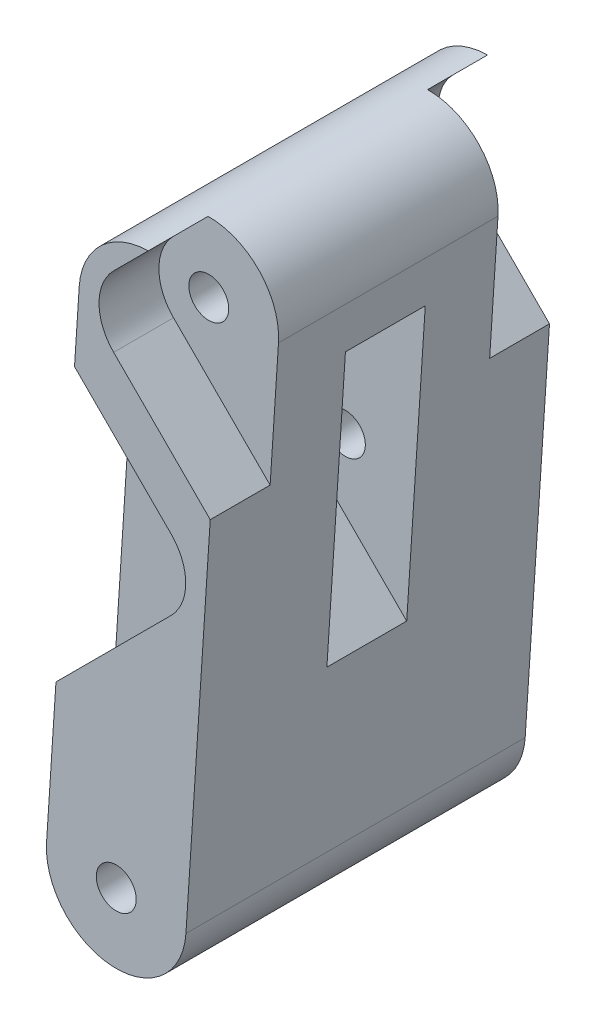
from build123d import *

# Parameters (mm, degrees)
SKETCH1_R           = 1
BOSS_EXTRUDE1_DEPTH = 8.5
CUT_EXTRUDE1_DEPTH  = 2
CUT_EXTRUDE2_START  = -3
CUT_EXTRUDE2_DEPTH  = 3


with BuildPart() as part:
    # Sketch1 → Boss-Extrude1 (new body)
    with BuildSketch(Plane.XY):
        with BuildLine():
            Line((12.42679356, 42.170979879), (10.789298219, 17.224665341))
            ThreePointArc((10.789298219, 17.224665341), (7.067564836, 13.961430653), (3.804330148, 17.683164036))
            Line((3.804330148, 17.683164036), (5.441825489, 42.629478574))
            ThreePointArc((5.441825489, 42.629478574), (9.163558872, 45.892713262), (12.42679356, 42.170979879))
        make_face()
        with Locations((7.296814184, 17.453914689)):
            Circle(SKETCH1_R, mode=Mode.SUBTRACT)
        with Locations((8.279311388, 32.421703411)):
            Circle(SKETCH1_R, mode=Mode.SUBTRACT)
        with Locations((8.934309525, 42.400229226)):
            Circle(SKETCH1_R, mode=Mode.SUBTRACT)
    boss_extrude1 = extrude(amount=BOSS_EXTRUDE1_DEPTH)

    # Sketch2 → Cut-Extrude1 (cut)
    # profile 1 of 2: a face of its own
    with BuildSketch(Plane(origin=(0, 0, 0), x_dir=(-1, 0, 0), z_dir=(0, 0, -1))):
        with BuildLine():
            ThreePointArc((-6.511544435, 30.653936458), (-5.779311388, 32.421703411), (-6.511544435, 34.189470364))
            Line((-6.511544435, 34.189470364), (-12.281634265, 39.959560194))
            Line((-12.281634265, 39.959560194), (-11.353008502, 25.812472391))
            Line((-11.353008502, 25.812472391), (-6.511544435, 30.653936458))
        make_face()
        with BuildLine():
            ThreePointArc((-7.279311388, 32.421703411), (-7.355431856, 32.039019979), (-7.572204607, 31.71459663))
            ThreePointArc((-7.572204607, 31.71459663), (-9.203190921, 32.804386844), (-7.279311388, 32.421703411))
        make_face(mode=Mode.SUBTRACT)
    # profile 2 of 2: a face of its own
    with BuildSketch(Plane(origin=(0, 0, 0), x_dir=(-1, 0, 0), z_dir=(0, 0, -1))):
        with BuildLine():
            ThreePointArc((-9.064581137, 19.221681642), (-9.796814184, 17.453914689), (-9.064581137, 15.686147736))
            Line((-9.064581137, 15.686147736), (-3.30921397, 9.930780569))
            Line((-3.30921397, 9.930780569), (-3.30921397, 24.977048808))
            Line((-3.30921397, 24.977048808), (-9.064581137, 19.221681642))
        make_face()
    cut_extrude1 = extrude(amount=-CUT_EXTRUDE1_DEPTH, mode=Mode.SUBTRACT)

    # Sketch3 → Cut-Extrude2 (cut)
    with BuildSketch(Plane.XY.offset(8.5).offset(CUT_EXTRUDE2_START)):
        with BuildLine():
            Line((7.166542572, 44.167996179), (14.185239134, 51.186692741))
            Line((14.185239134, 51.186692741), (14.789130122, 33.009874723))
            Line((14.789130122, 33.009874723), (7.166542572, 40.632462273))
            ThreePointArc((7.166542572, 40.632462273), (6.434309525, 42.400229226), (7.166542572, 44.167996179))
        make_face()
        with BuildLine():
            Line((10.047078341, 34.189470364), (4.005126991, 40.231421715))
            Line((4.005126991, 40.231421715), (3.260559385, 23.867417502))
            Line((3.260559385, 23.867417502), (10.047078341, 30.653936458))
            ThreePointArc((10.047078341, 30.653936458), (10.779311388, 32.421703411), (10.047078341, 34.189470364))
        make_face()
    cut_extrude2 = extrude(amount=CUT_EXTRUDE2_DEPTH, mode=Mode.SUBTRACT)

    # Mirror1: Boss-Extrude1, Cut-Extrude1, Cut-Extrude2 across plane
    add(boss_extrude1.mirror(Plane(origin=(0, 0, 0), x_dir=(1, 0, 0), z_dir=(0, 0, -1))))
    add(cut_extrude1.mirror(Plane(origin=(0, 0, 0), x_dir=(1, 0, 0), z_dir=(0, 0, -1))), mode=Mode.SUBTRACT)
    add(cut_extrude2.mirror(Plane(origin=(0, 0, 0), x_dir=(1, 0, 0), z_dir=(0, 0, -1))), mode=Mode.SUBTRACT)


solid = part.part
